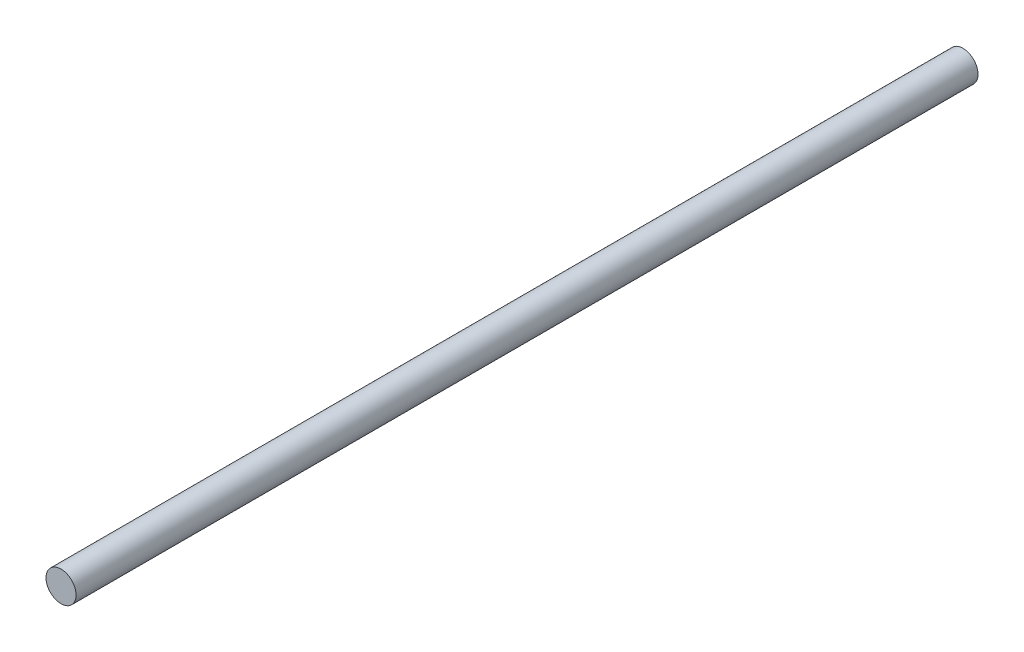
from build123d import *

# Parameters (mm, degrees)
SKETCH_1_R      = 3
EXTRUDE_1_DEPTH = 180


with BuildPart() as part:
    # 草图1 → 拉伸1 (new body)
    with BuildSketch(Plane.XY):
        with Locations(Location((0, 0, 0), (0, 0, 180))):
            Circle(SKETCH_1_R)
    extrude(amount=EXTRUDE_1_DEPTH)


solid = part.part
